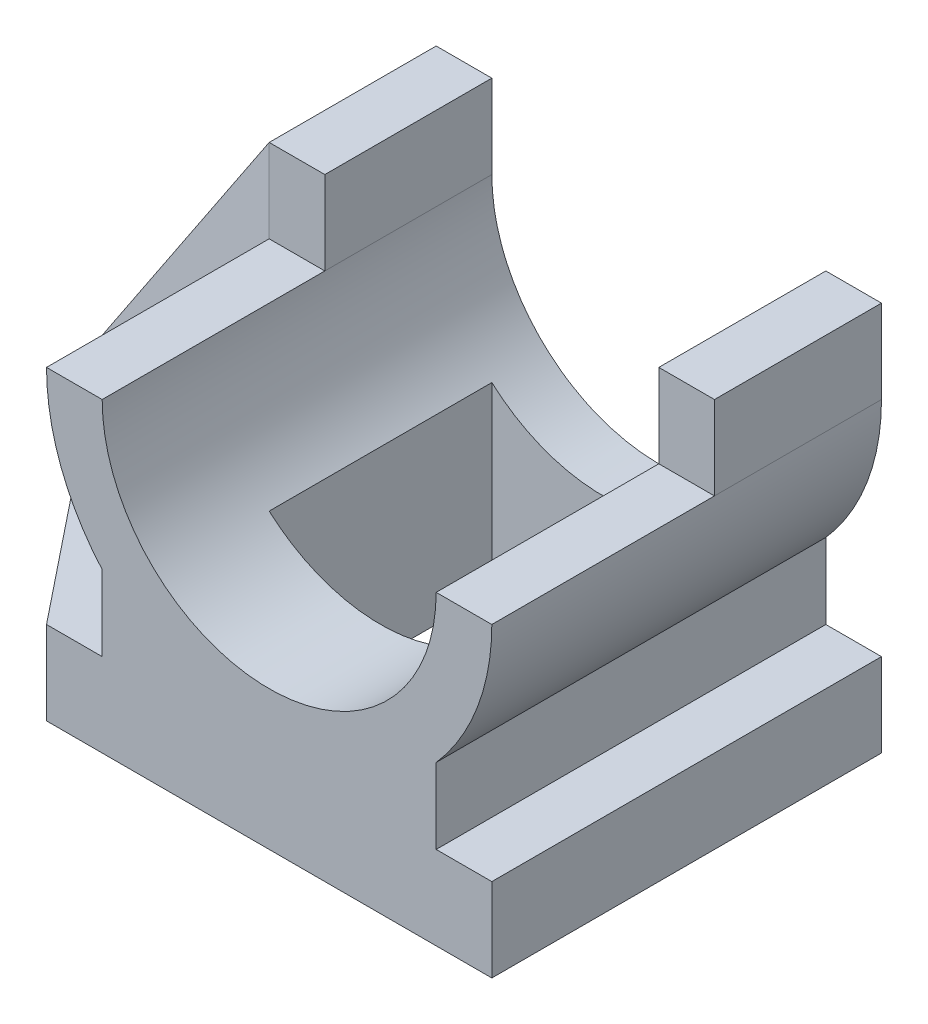
from build123d import *

# Parameters (mm, degrees)
SKETCH1_W               = 40
SKETCH1_H               = 70
BOSS_EXTRUDE1_DEPTH     = 15
BOSS_EXTRUDE2_DEPTH     = 70
SKETCH3_W               = 10
SKETCH3_H               = 15
BOSS_EXTRUDE3_DEPTH     = 30
CUT_EXTRUDE1_DEPTH      = 107.77078252
CUT_EXTRUDE1_DEPTH_BACK = 107.77078252
CUT_EXTRUDE2_DEPTH      = 107.77078252
CUT_EXTRUDE2_DEPTH_BACK = 107.77078252
SKETCH5_W               = 40
SKETCH5_H               = 40
BOSS_EXTRUDE4_DEPTH     = 15
BOSS_EXTRUDE5_DEPTH     = 30
CUT_EXTRUDE3_START      = 15
CUT_EXTRUDE3_DEPTH      = 60


with BuildPart() as part:
    # Sketch1 → Boss-Extrude1 (new body)
    with BuildSketch(Plane(origin=(0, 0, 0), x_dir=(1, 0, 0), z_dir=(0, 1, 0))):
        with Locations((20, -35)):
            Rectangle(SKETCH1_W, SKETCH1_H)
    boss_extrude1 = extrude(amount=BOSS_EXTRUDE1_DEPTH)

    # Sketch2 → Boss-Extrude2 (add)
    with BuildSketch(Plane.XY):
        with BuildLine():
            Line((0, 15), (30, 15))
            Line((30, 15), (30, 28.542486889))
            ThreePointArc((30, 28.542486889), (37.416573868, 40.857864376), (40, 55))
            Line((40, 55), (0, 55))
            Line((0, 55), (0, 15))
        make_face()
    boss_extrude2 = extrude(amount=BOSS_EXTRUDE2_DEPTH)

    # Sketch3 → Boss-Extrude3 (add)
    with BuildSketch(Plane.XY):
        with Locations((35, 62.5)):
            Rectangle(SKETCH3_W, SKETCH3_H)
    boss_extrude3 = extrude(amount=BOSS_EXTRUDE3_DEPTH)

    # Mirror1: Boss-Extrude1, Boss-Extrude2, Boss-Extrude3 across plane
    add(boss_extrude1.mirror(Plane(origin=(0, 0, 0), x_dir=(0, 0, 1), z_dir=(1, 0, 0))))
    add(boss_extrude2.mirror(Plane(origin=(0, 0, 0), x_dir=(0, 0, 1), z_dir=(1, 0, 0))))
    add(boss_extrude3.mirror(Plane(origin=(0, 0, 0), x_dir=(0, 0, 1), z_dir=(1, 0, 0))))

    # Sketch4 → Cut-Extrude1 (cut, two sides: drawn at the far end of the back side and taken through both)
    with BuildSketch(Plane.XY.offset(-CUT_EXTRUDE1_DEPTH_BACK)):
        with BuildLine():
            Line((-30, 72), (-30, 55))
            ThreePointArc((-30, 55), (0, 25), (30, 55))
            Line((30, 55), (30, 72))
            Line((30, 72), (-30, 72))
        make_face()
    extrude(amount=CUT_EXTRUDE1_DEPTH + CUT_EXTRUDE1_DEPTH_BACK, mode=Mode.SUBTRACT)

    # Sketch5 → Cut-Extrude2 (cut, two sides: drawn at the far end of the back side and taken through both)
    with BuildSketch(Plane(origin=(0, 0, 0), x_dir=(1, 0, 0), z_dir=(0, 1, 0)).offset(-CUT_EXTRUDE2_DEPTH_BACK)):
        with Locations((0, -30)):
            Rectangle(SKETCH5_W, SKETCH5_H)
    extrude(amount=CUT_EXTRUDE2_DEPTH + CUT_EXTRUDE2_DEPTH_BACK, mode=Mode.SUBTRACT)

    # Sketch6 → Boss-Extrude4 (add)
    with BuildSketch(Plane(origin=(0, 0, 0), x_dir=(1, 0, 0), z_dir=(0, 1, 0))):
        Polygon((-40, 0), (-80, 0), (-80, -20), (-40, -70), align=None)
    extrude(amount=BOSS_EXTRUDE4_DEPTH)

    # Sketch7 → Boss-Extrude5 (add)
    with BuildSketch(Plane.XY):
        Polygon((-80, 15), (-40, 70), (-40, 55), (-30, 55), (-30, 15), align=None)
    extrude(amount=BOSS_EXTRUDE5_DEPTH)

    # Sketch8 → Cut-Extrude3 (cut)
    with BuildSketch(Plane(origin=(0, 0, 0), x_dir=(1, 0, 0), z_dir=(0, 1, 0)).offset(CUT_EXTRUDE3_START)):
        Polygon((-80, -20), (-40, -30), (-80, -30), align=None)
    extrude(amount=CUT_EXTRUDE3_DEPTH, mode=Mode.SUBTRACT)


solid = part.part
